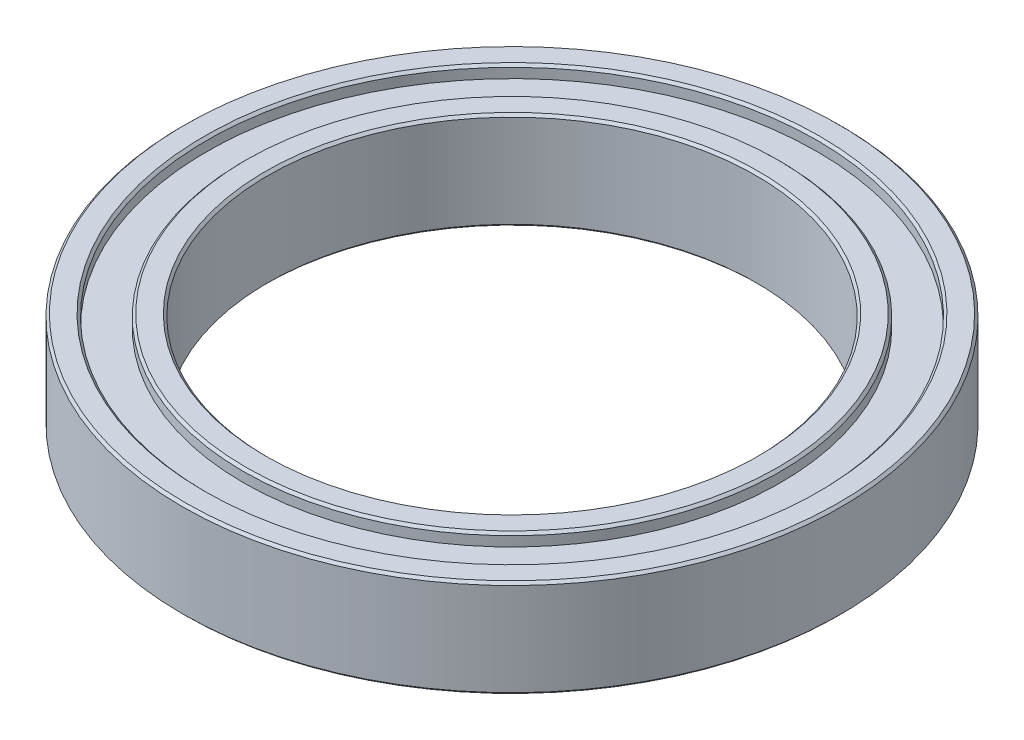
from build123d import *

# Parameters (mm, degrees)
SKETCH_1_R          = 13.5
SKETCH_1_R_2        = 10
EXTRUDE_1_DEPTH     = 4
SKETCH_2_R          = 12.5
SKETCH_2_R_2        = 11
CUT_EXTRUDE_1_DEPTH = 0.5
CHAMFER_1_SIZE      = 0.1


with BuildPart() as part:
    # 草图1 → 凸台-拉伸1 (new body)
    with BuildSketch(Plane(origin=(0, 0, 0), x_dir=(1, 0, 0), z_dir=(0, 1, 0))):
        with Locations(Location((0, 0, 0), (0, 0, 270))):
            Circle(SKETCH_1_R)
        with Locations(Location((0, 0, 0), (0, 0, 270))):
            Circle(SKETCH_1_R_2, mode=Mode.SUBTRACT)
    extrude(amount=EXTRUDE_1_DEPTH)

    # 草图2 → 切除-拉伸1 (cut)
    with BuildSketch(Plane(origin=(0, 4, 0), x_dir=(1, 0, 0), z_dir=(0, 1, 0))):
        with Locations(Location((0, 0, 0), (0, 0, 270))):
            Circle(SKETCH_2_R)
        with Locations(Location((0, 0, 0), (0, 0, 270))):
            Circle(SKETCH_2_R_2, mode=Mode.SUBTRACT)
    cut_extrude_1 = extrude(amount=-CUT_EXTRUDE_1_DEPTH, mode=Mode.SUBTRACT)

    # 镜向1: 切除-拉伸1 across plane
    add(cut_extrude_1.mirror(Plane.ZX.offset(2)), mode=Mode.SUBTRACT)

    # 倒角1
    chamfer_1_edges = [part.edges().sort_by_distance(p)[0] for p in [
        (0, 4, -12.5),
        (0, 4, -11),
        (0, 0, -11),
        (0, 0, -12.5),
        (0, 0, -13.5),
        (0, 4, -13.5),
        (0, 0, -10),
        (0, 4, -10),
    ]]
    chamfer(chamfer_1_edges, length=CHAMFER_1_SIZE)


solid = part.part
